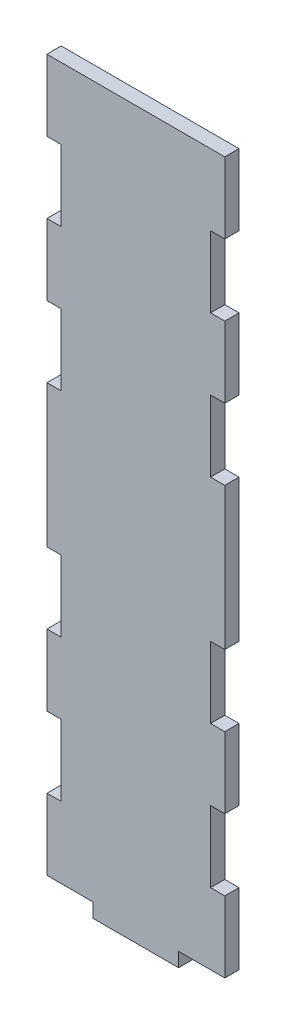
from build123d import *

# Parameters (mm, degrees)
RESSALTO_EXTRUS_O1_DEPTH = 4
ESBO_O2_W                = 4
ESBO_O2_H                = 20
CORTE_EXTRUS_O1_DEPTH    = 116.464280191
ESBO_O3_W                = 4
ESBO_O3_H                = 20
CORTE_EXTRUS_O2_DEPTH    = 116.464280191


with BuildPart() as part:
    # Esboço1 → Ressalto-extrusão1 (new body)
    with BuildSketch(Plane.XY):
        Polygon((-50, -100), (-37, -100), (-37, -104), (-13, -104), (-13, -100), (13, -100), (13, -104), (37, -104), (37, -100), (50, -100), (50, 100), (-50, 100), align=None)
    extrude(amount=RESSALTO_EXTRUS_O1_DEPTH)

    # Esboço2 → Corte-extrusão1 (cut, through all)
    with BuildSketch(Plane.XY.offset(4)):
        Polygon((-50, 0), (0, 0), (0, 20), (0, 40), (0, 60), (0, 80), (0, 100), (-50, 100), align=None)
        Polygon((-13, -100), (0, -100), (0, -80), (0, -60), (0, -40), (0, -20), (0, 0), (-50, 0), (-50, -100), (-37, -100), (-37, -104), (-13, -104), align=None)
        with Locations((2, 70)):
            Rectangle(ESBO_O2_W, ESBO_O2_H)
        with Locations((2, -30)):
            Rectangle(ESBO_O2_W, ESBO_O2_H)
        with Locations((2, -70)):
            Rectangle(ESBO_O2_W, ESBO_O2_H)
        with Locations((2, 30)):
            Rectangle(ESBO_O2_W, ESBO_O2_H)
    extrude(amount=-CORTE_EXTRUS_O1_DEPTH, mode=Mode.SUBTRACT)

    # Esboço3 → Corte-extrusão2 (cut, through all)
    with BuildSketch(Plane.XY.offset(4)):
        with Locations((48, 70)):
            Rectangle(ESBO_O3_W, ESBO_O3_H)
        with Locations((48, 30)):
            Rectangle(ESBO_O3_W, ESBO_O3_H)
        with Locations((48, -70)):
            Rectangle(ESBO_O3_W, ESBO_O3_H)
        with Locations((48, -30)):
            Rectangle(ESBO_O3_W, ESBO_O3_H)
    extrude(amount=-CORTE_EXTRUS_O2_DEPTH, mode=Mode.SUBTRACT)


solid = part.part
